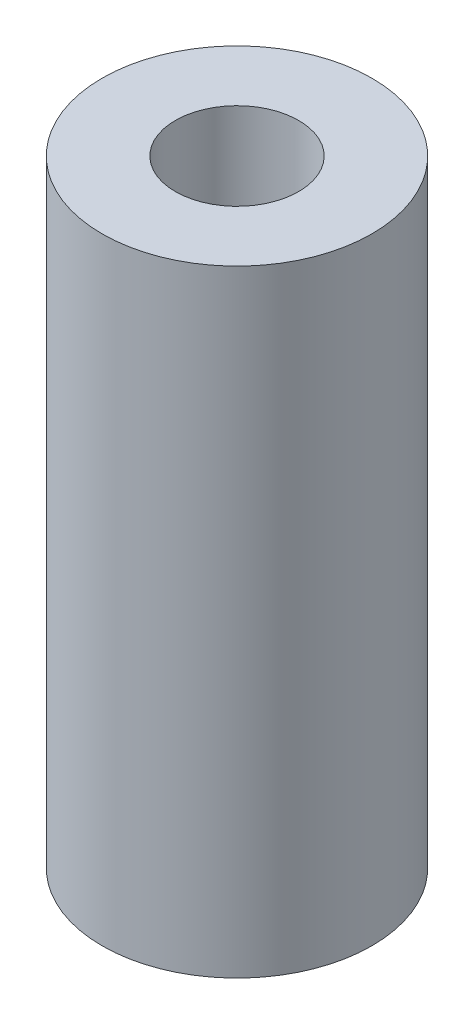
from build123d import *

# Parameters (mm, degrees)
SKETCH1_W             = 1.75
SKETCH1_H             = 8
M2X0_4_TAPPED_HOLE1_D = 1.6


with BuildPart() as part:
    # Sketch1 → Revolve1 (revolve)
    with BuildSketch(Plane.XY, mode=Mode.PRIVATE) as revolve1_sk:
        with Locations((-0.875, 4)):
            Rectangle(SKETCH1_W, SKETCH1_H)
    revolve(revolve1_sk.sketch.rotate(Axis((0, 0, 0), (0, 1, 0)), 270), axis=Axis((0, 0, 0), (0, 1, 0)))

    # M2x0.4 Tapped Hole1 (through all)
    with Locations(Plane(origin=(0, 8, 0), x_dir=(-1, 0, 0), z_dir=(0, 1, 0))):
        with Locations((0, 0)):
            Hole(M2X0_4_TAPPED_HOLE1_D / 2)


solid = part.part
